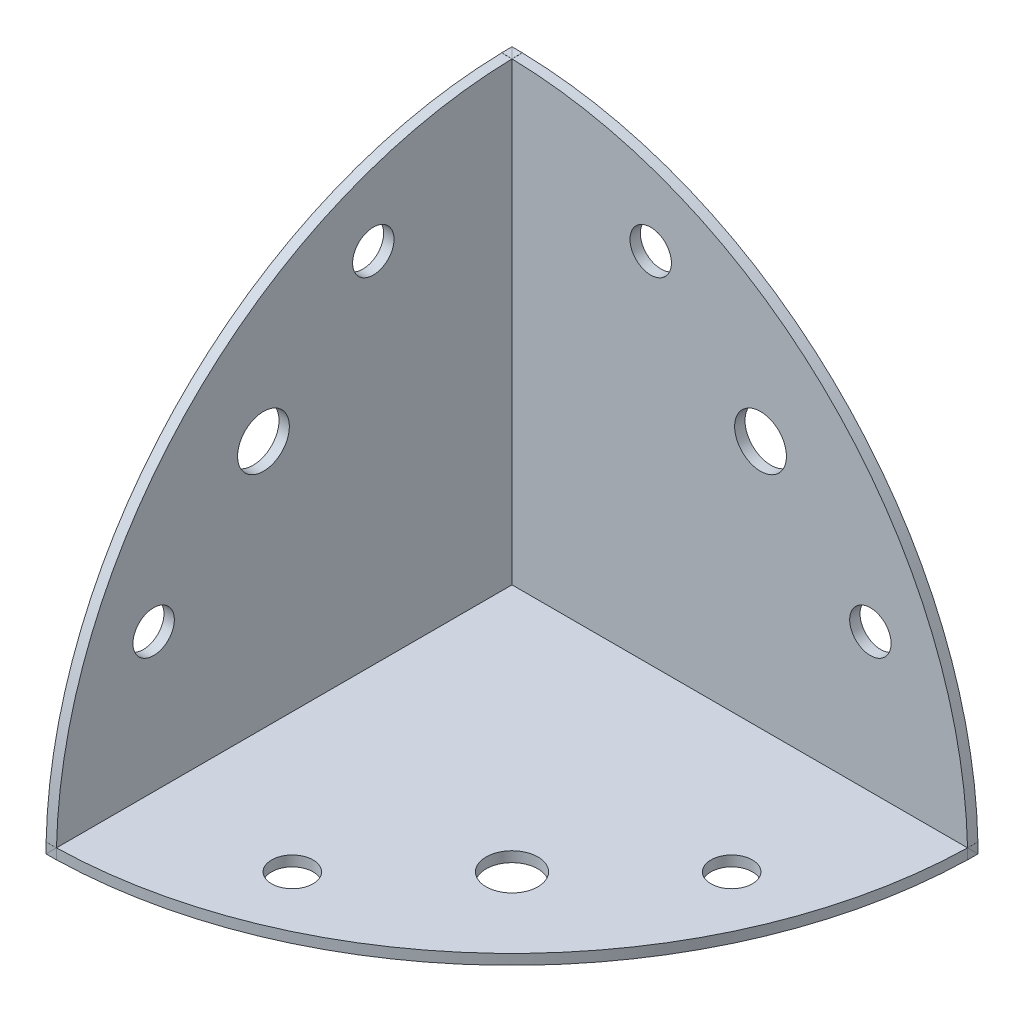
from build123d import *

# Parameters (mm, degrees)
SKETCH_2_R      = 2.5
SKETCH_2_R_2    = 2
EXTRUDE_1_DEPTH = 1
SKETCH_3_R      = 2.5
SKETCH_3_R_2    = 2
EXTRUDE_2_DEPTH = 1
SKETCH_5_R      = 2.5
SKETCH_5_R_2    = 2
EXTRUDE_3_DEPTH = 1


with BuildPart() as part:
    # Эскиз2 → Бобышка-Вытянуть1 (new body)
    with BuildSketch(Plane(origin=(0, 0, 0), x_dir=(1, 0, 0), z_dir=(0, 1, 0))):
        with BuildLine():
            Line((0, -45), (0, 0))
            Line((0, 0), (45, 0))
            ThreePointArc((45, 0), (31.819805153, -31.819805153), (0, -45))
        make_face()
        with Locations(Location((25, -25, 0), (0, 0, 270))):
            Circle(SKETCH_2_R, mode=Mode.SUBTRACT)
        with Locations(Location((14.393398282, -35.606601718, 0), (0, 0, 270))):
            Circle(SKETCH_2_R_2, mode=Mode.SUBTRACT)
        with Locations(Location((35.606601718, -14.393398282, 0), (0, 0, 90))):
            Circle(SKETCH_2_R_2, mode=Mode.SUBTRACT)
    extrude(amount=EXTRUDE_1_DEPTH)

    # Эскиз3 → Бобышка-Вытянуть2 (add)
    with BuildSketch(Plane.XY):
        with BuildLine():
            Line((0, 45), (0, 0))
            Line((0, 0), (45, 0))
            ThreePointArc((45, 0), (31.819805153, 31.819805153), (0, 45))
        make_face()
        with Locations((25, 25)):
            Circle(SKETCH_3_R, mode=Mode.SUBTRACT)
        with Locations((14.393398282, 35.606601718)):
            Circle(SKETCH_3_R_2, mode=Mode.SUBTRACT)
        with Locations(Location((35.606601718, 14.393398282, 0), (0, 0, 180))):
            Circle(SKETCH_3_R_2, mode=Mode.SUBTRACT)
    extrude(amount=EXTRUDE_2_DEPTH)

    # Эскиз5 → Бобышка-Вытянуть3 (add)
    with BuildSketch(Plane(origin=(0, 0, 0), x_dir=(0, 0, -1), z_dir=(1, 0, 0))):
        with BuildLine():
            Line((0, 45), (0, 0))
            Line((0, 0), (-45, 0))
            ThreePointArc((-45, 0), (-31.819805153, 31.819805153), (0, 45))
        make_face()
        with Locations((-25, 25)):
            Circle(SKETCH_5_R, mode=Mode.SUBTRACT)
        with Locations((-14.393398282, 35.606601718)):
            Circle(SKETCH_5_R_2, mode=Mode.SUBTRACT)
        with Locations(Location((-35.606601718, 14.393398282, 0), (0, 0, 180))):
            Circle(SKETCH_5_R_2, mode=Mode.SUBTRACT)
    extrude(amount=EXTRUDE_3_DEPTH)


solid = part.part
